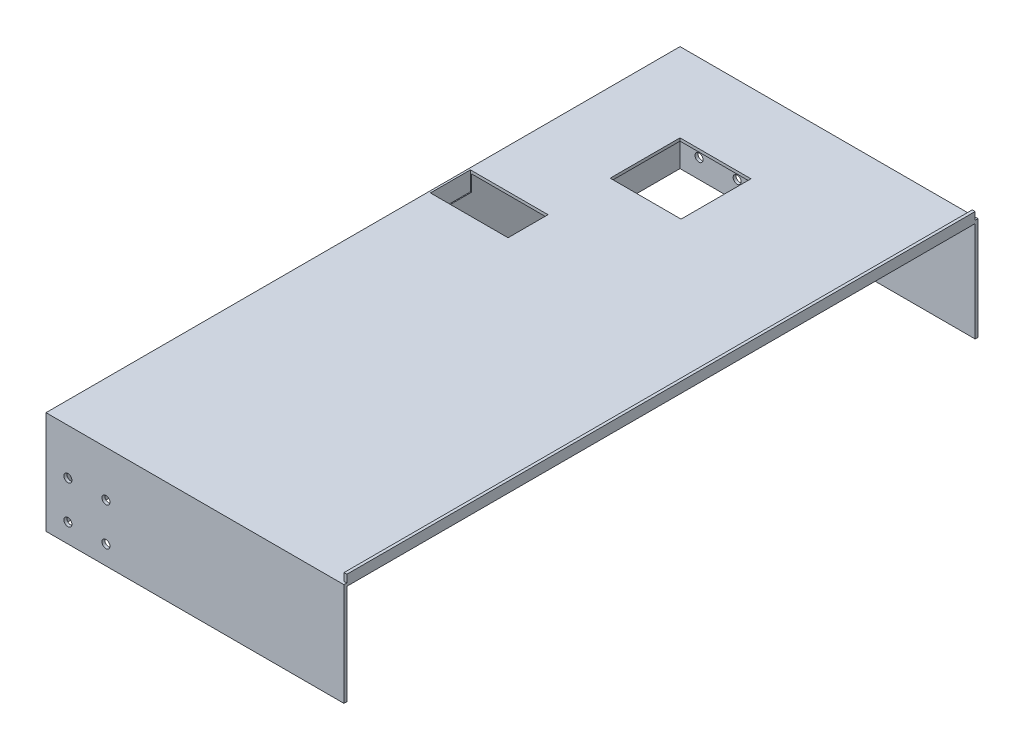
from build123d import *

# Parameters (mm, degrees)
BOSS_EXTRUDE4_DEPTH  = 1.5
SKETCH5_W            = 155
SKETCH5_H            = 54
BOSS_EXTRUDE5_DEPTH  = 1.5
SKETCH8_W            = 1.5
SKETCH8_H            = 330
BOSS_EXTRUDE14_DEPTH = 4
SKETCH7_W            = 155
SKETCH7_H            = 54
BOSS_EXTRUDE18_DEPTH = 1.5
SKETCH9_W            = 333
SKETCH9_H            = 54
BOSS_EXTRUDE19_DEPTH = 1.5
SKETCH10_R           = 2.1
CUT_EXTRUDE1_DEPTH   = 10
CUT_EXTRUDE2_START   = -10
SKETCH17_R           = 2.1
CUT_EXTRUDE2_DEPTH   = 10
SKETCH16_R           = 2.1
CUT_EXTRUDE3_DEPTH   = 10
CUT_EXTRUDE4_START   = -10
SKETCH11_R           = 2.1
CUT_EXTRUDE4_DEPTH   = 10
SKETCH12_R           = 2.1
CUT_EXTRUDE5_DEPTH   = 10
SKETCH13_R           = 2.1
CUT_EXTRUDE6_DEPTH   = 10
CUT_EXTRUDE7_START   = -10
SKETCH14_R           = 2.1
CUT_EXTRUDE7_DEPTH   = 10
CUT_EXTRUDE8_START   = -10
SKETCH15_R           = 2.1
CUT_EXTRUDE8_DEPTH   = 10
SKETCH18_W           = 40.776716255
SKETCH18_H           = 21.003646254
CUT_EXTRUDE9_DEPTH   = 10
SKETCH21_W           = 37.24685685
SKETCH21_H           = 36.694897388
CUT_EXTRUDE12_DEPTH  = 10


with BuildPart() as part:
    # Sketch4 → Boss-Extrude4 (new body)
    with BuildSketch(Plane(origin=(0, 0, 0), x_dir=(1, 0, 0), z_dir=(0, 1, 0))):
        Polygon((179.47837592, 330), (334.47837592, 330), (334.47837592, 0), (179.47837592, 0), (179.47837592, 200), (179.47837592, 265), align=None)
    extrude(amount=BOSS_EXTRUDE4_DEPTH)

    # Sketch5 → Boss-Extrude5 (add)
    with BuildSketch(Plane.XY):
        with Locations((256.97837592, -25.5)):
            Rectangle(SKETCH5_W, SKETCH5_H)
    extrude(amount=BOSS_EXTRUDE5_DEPTH)

    # Sketch8 → Boss-Extrude14 (add)
    with BuildSketch(Plane(origin=(0, 1.5, 0), x_dir=(1, 0, 0), z_dir=(0, 1, 0))):
        with Locations((333.72837592, 165)):
            Rectangle(SKETCH8_W, SKETCH8_H)
    extrude(amount=BOSS_EXTRUDE14_DEPTH)

    # Sketch7 → Boss-Extrude18 (add)
    with BuildSketch(Plane(origin=(0, 0, -330), x_dir=(-1, 0, 0), z_dir=(0, 0, -1))):
        with Locations((-256.97837592, -25.5)):
            Rectangle(SKETCH7_W, SKETCH7_H)
    extrude(amount=BOSS_EXTRUDE18_DEPTH)

    # Sketch9 → Boss-Extrude19 (add)
    with BuildSketch(Plane.ZY.offset(-179.47837592)):
        with Locations((-165, -25.5)):
            Rectangle(SKETCH9_W, SKETCH9_H)
    extrude(amount=BOSS_EXTRUDE19_DEPTH)

    # Sketch10 → Cut-Extrude1 (cut)
    with BuildSketch(Plane(origin=(0, 0, -331.5), x_dir=(-1, 0, 0), z_dir=(0, 0, -1))):
        with Locations((-209.47837592, -42.5)):
            Circle(SKETCH10_R)
    extrude(amount=-CUT_EXTRUDE1_DEPTH, mode=Mode.SUBTRACT)

    # Sketch17 → Cut-Extrude2 (cut)
    with BuildSketch(Plane.XY.offset(1.5).offset(CUT_EXTRUDE2_START)):
        with Locations(Location((209.47837592, -42.5, 0), (0, 0, 180))):
            Circle(SKETCH17_R)
    extrude(amount=CUT_EXTRUDE2_DEPTH, mode=Mode.SUBTRACT)

    # Sketch16 → Cut-Extrude3 (cut)
    with BuildSketch(Plane.XY.offset(1.5)):
        with Locations((189.47837592, -42.5)):
            Circle(SKETCH16_R)
    extrude(amount=-CUT_EXTRUDE3_DEPTH, mode=Mode.SUBTRACT)

    # Sketch11 → Cut-Extrude4 (cut)
    with BuildSketch(Plane(origin=(0, 0, -331.5), x_dir=(-1, 0, 0), z_dir=(0, 0, -1)).offset(CUT_EXTRUDE4_START)):
        with Locations(Location((-189.47837592, -42.5, 0), (0, 0, 180))):
            Circle(SKETCH11_R)
    extrude(amount=CUT_EXTRUDE4_DEPTH, mode=Mode.SUBTRACT)

    # Sketch12 → Cut-Extrude5 (cut)
    with BuildSketch(Plane(origin=(0, 0, -331.5), x_dir=(-1, 0, 0), z_dir=(0, 0, -1))):
        with Locations((-189.47837592, -22.5)):
            Circle(SKETCH12_R)
    extrude(amount=-CUT_EXTRUDE5_DEPTH, mode=Mode.SUBTRACT)

    # Sketch13 → Cut-Extrude6 (cut)
    with BuildSketch(Plane(origin=(0, 0, -331.5), x_dir=(-1, 0, 0), z_dir=(0, 0, -1))):
        with Locations((-209.47837592, -22.5)):
            Circle(SKETCH13_R)
    extrude(amount=-CUT_EXTRUDE6_DEPTH, mode=Mode.SUBTRACT)

    # Sketch14 → Cut-Extrude7 (cut)
    with BuildSketch(Plane.XY.offset(1.5).offset(CUT_EXTRUDE7_START)):
        with Locations(Location((189.47837592, -22.5, 0), (0, 0, 180))):
            Circle(SKETCH14_R)
    extrude(amount=CUT_EXTRUDE7_DEPTH, mode=Mode.SUBTRACT)

    # Sketch15 → Cut-Extrude8 (cut)
    with BuildSketch(Plane.XY.offset(1.5).offset(CUT_EXTRUDE8_START)):
        with Locations(Location((209.47837592, -22.5, 0), (0, 0, 180))):
            Circle(SKETCH15_R)
    extrude(amount=CUT_EXTRUDE8_DEPTH, mode=Mode.SUBTRACT)

    # Sketch18 → Cut-Extrude9 (cut)
    with BuildSketch(Plane(origin=(0, 1.5, 0), x_dir=(1, 0, 0), z_dir=(0, 1, 0))):
        with Locations((199.375823154, 209.882956498)):
            Rectangle(SKETCH18_W, SKETCH18_H)
    extrude(amount=-CUT_EXTRUDE9_DEPTH, mode=Mode.SUBTRACT)

    # Sketch21 → Cut-Extrude12 (cut)
    with BuildSketch(Plane(origin=(0, 1.5, 0), x_dir=(1, 0, 0), z_dir=(0, 1, 0))):
        with Locations((238.101804345, 271.652551306)):
            Rectangle(SKETCH21_W, SKETCH21_H)
    extrude(amount=-CUT_EXTRUDE12_DEPTH, mode=Mode.SUBTRACT)


solid = part.part
